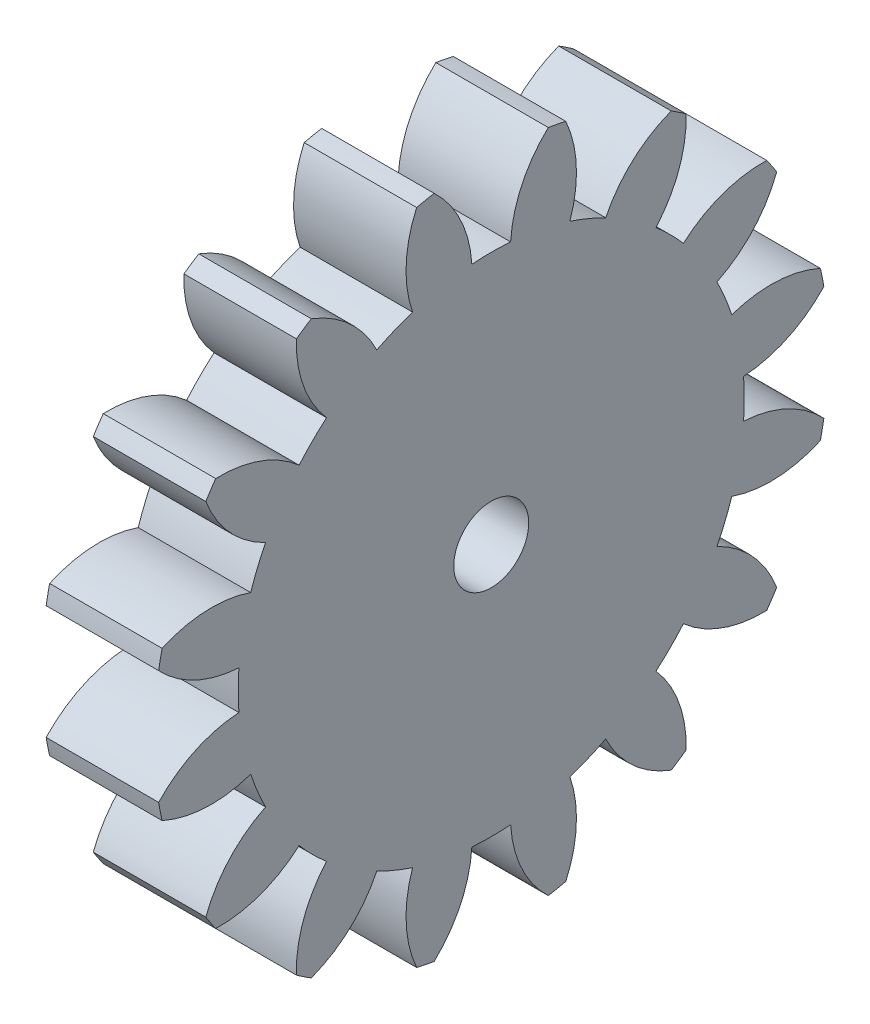
from build123d import *

# Parameters (mm, degrees)
BASPROSKE_W     = 6
BASPROSKE_H     = 18
TOOTHCUT_DEPTH  = 27.153393661
TEETHCUTS_COUNT = 16
TEETHCUTS_ANGLE = 337.5
BORSKE_R        = 2
BORE_DEPTH      = 50.0000508


with BuildPart() as part:
    # BasProSke → Base-Revolve (revolve)
    with BuildSketch(Plane(origin=(0, 0, 0), x_dir=(1, 0, 0), z_dir=(0, 1, 0)), mode=Mode.PRIVATE) as base_revolve_sk:
        with Locations((3, 9)):
            Rectangle(BASPROSKE_W, BASPROSKE_H)
    revolve(base_revolve_sk.sketch.rotate(Axis((-10, 0, 0), (1, 0, 0)), 180), axis=Axis((-10, 0, 0), (1, 0, 0)))

    # TooCutSke → ToothCut (cut, through all)
    with BuildSketch(Plane(origin=(0, 0, 0), x_dir=(0, 0, -1), z_dir=(1, 0, 0))):
        with BuildLine():
            ThreePointArc((1.03434411, 13.459313997), (0, 13.499), (-1.03434411, 13.459313997))
            ThreePointArc((-1.03434411, 13.459313997), (-1.635143665, 15.806872195), (-3.065655864, 17.762792553))
            ThreePointArc((-3.065655864, 17.762792553), (0, 18.0254), (3.065655864, 17.762792553))
            ThreePointArc((3.065655864, 17.762792553), (1.635143665, 15.806872195), (1.03434411, 13.459313997))
        make_face()
    toothcut = extrude(amount=TOOTHCUT_DEPTH, mode=Mode.SUBTRACT)

    # TeethCuts: ToothCut ×16 about axis
    teethcuts_axis = Axis((-10, 0, 0), (1, 0, 0))
    for i in range(1, TEETHCUTS_COUNT):
        add(toothcut.rotate(teethcuts_axis, i * TEETHCUTS_ANGLE / (TEETHCUTS_COUNT - 1)), mode=Mode.SUBTRACT)

    # BorSke → Bore (cut, symmetric)
    with BuildSketch(Plane(origin=(0, 0, 0), x_dir=(0, 0, -1), z_dir=(1, 0, 0))):
        with Locations(Location((0, 0, 0), (0, 0, 180))):
            Circle(BORSKE_R)
    extrude(amount=BORE_DEPTH, both=True, mode=Mode.SUBTRACT)


solid = part.part
